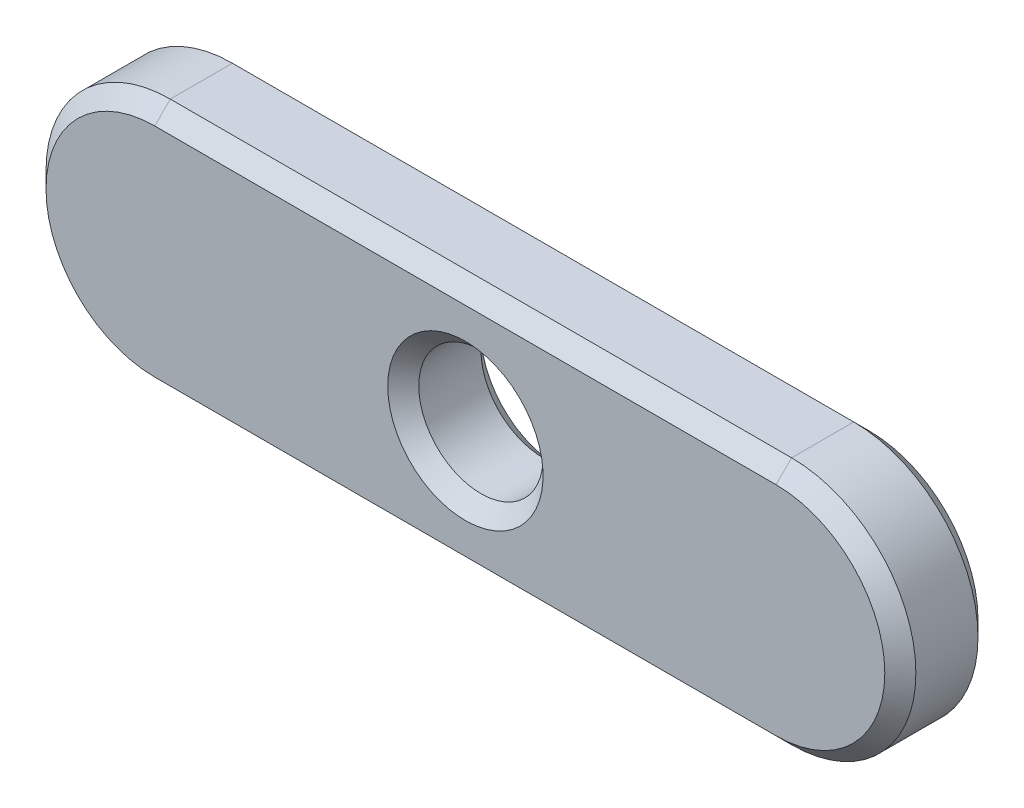
from build123d import *

# Parameters (mm, degrees)
BASE_EXTRUSION_DEPTH    = 3
ESQUISSE2_R             = 2
ENL_V_MAT_EXTRU_1_DEPTH = 3
CHANFREIN1_SIZE         = 0.5


with BuildPart() as part:
    # Esquisse1 → Base-Extrusion (new body)
    with BuildSketch(Plane.XY):
        with BuildLine():
            Line((-10, 4), (10, 4))
            ThreePointArc((10, 4), (14, 0), (10, -4))
            Line((10, -4), (-10, -4))
            ThreePointArc((-10, -4), (-14, 0), (-10, 4))
        make_face()
    extrude(amount=BASE_EXTRUSION_DEPTH)

    # Esquisse2 → Enlèv. mat.-Extru.1 (cut)
    with BuildSketch(Plane.XY.offset(3)):
        with Locations(Location((0, 0, 0), (0, 0, 180))):
            Circle(ESQUISSE2_R)
    extrude(amount=-ENL_V_MAT_EXTRU_1_DEPTH, mode=Mode.SUBTRACT)

    # Chanfrein1
    chanfrein1_edges = [part.edges().sort_by_distance(p)[0] for p in [
        (0, -4, 0),
        (0, -4, 3),
        (14, 0, 0),
        (14, 0, 3),
        (-14, 0, 0),
        (-14, 0, 3),
        (0, 4, 0),
        (2, 0, 0),
        (0, 4, 3),
        (2, 0, 3),
    ]]
    chamfer(chanfrein1_edges, length=CHANFREIN1_SIZE)


solid = part.part
